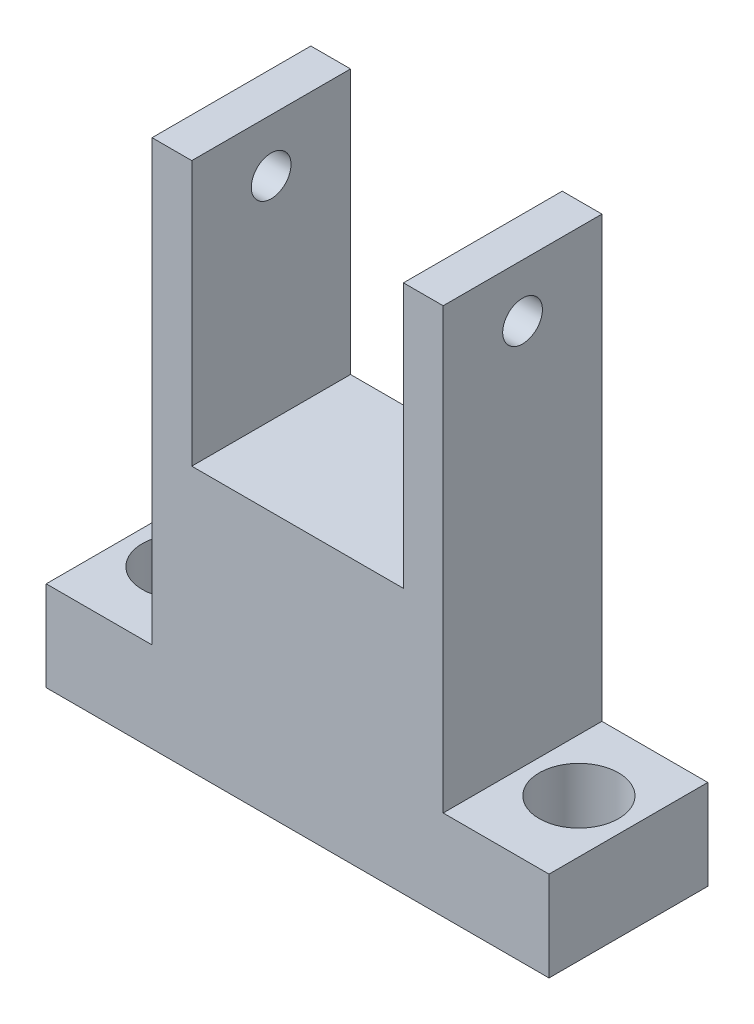
from build123d import *

# Parameters (mm, degrees)
SKETCH1_R               = 1.5
BOSS_EXTRUDE1_DEPTH     = 3.4
SKETCH1_4_W             = 1.5
SKETCH1_4_H             = 6
BOSS_EXTRUDE2_DEPTH     = 20
CUT_EXTRUDE1_DEPTH      = 26.179356624
CUT_EXTRUDE1_DEPTH_BACK = 26.179356624
SKETCH2_R               = 0.75
BOSS_EXTRUDE3_DEPTH     = 10


with BuildPart() as part:
    # Sketch1 → Boss-Extrude1 (new body)
    with BuildSketch(Plane(origin=(0, 0, 0), x_dir=(1, 0, 0), z_dir=(0, 1, 0))):
        Polygon((-9.5, 3), (-9.5, -3), (9.5, -3), (9.5, 3), (0, 3), align=None)
        with Locations((-7.5, 0.128979829)):
            Circle(SKETCH1_R, mode=Mode.SUBTRACT)
        with Locations((7.5, 0.128979829)):
            Circle(SKETCH1_R, mode=Mode.SUBTRACT)
    extrude(amount=BOSS_EXTRUDE1_DEPTH)

    # Sketch1<4> → Boss-Extrude2 (add)
    with BuildSketch(Plane(origin=(0, 0, 0), x_dir=(1, 0, 0), z_dir=(0, 1, 0))):
        with Locations((-4.75, 0)):
            Rectangle(SKETCH1_4_W, SKETCH1_4_H)
        with Locations((4.75, 0)):
            Rectangle(SKETCH1_4_W, SKETCH1_4_H)
    extrude(amount=BOSS_EXTRUDE2_DEPTH)

    # Sketch2 → Cut-Extrude1 (cut, two sides: drawn at the far end of the back side and taken through both)
    with BuildSketch(Plane(origin=(5.5, 0, 0), x_dir=(0, 0, -1), z_dir=(1, 0, 0)).offset(-CUT_EXTRUDE1_DEPTH_BACK)):
        with Locations((0, 18)):
            Circle(SKETCH2_R)
    extrude(amount=CUT_EXTRUDE1_DEPTH + CUT_EXTRUDE1_DEPTH_BACK, mode=Mode.SUBTRACT)

    # Sketch1<5> → Boss-Extrude3 (add)
    with BuildSketch(Plane(origin=(0, 0, 0), x_dir=(1, 0, 0), z_dir=(0, 1, 0))):
        Polygon((0, 3), (-4, 3), (-4, -3), (4, -3), (4, 3), align=None)
    extrude(amount=BOSS_EXTRUDE3_DEPTH)


solid = part.part
